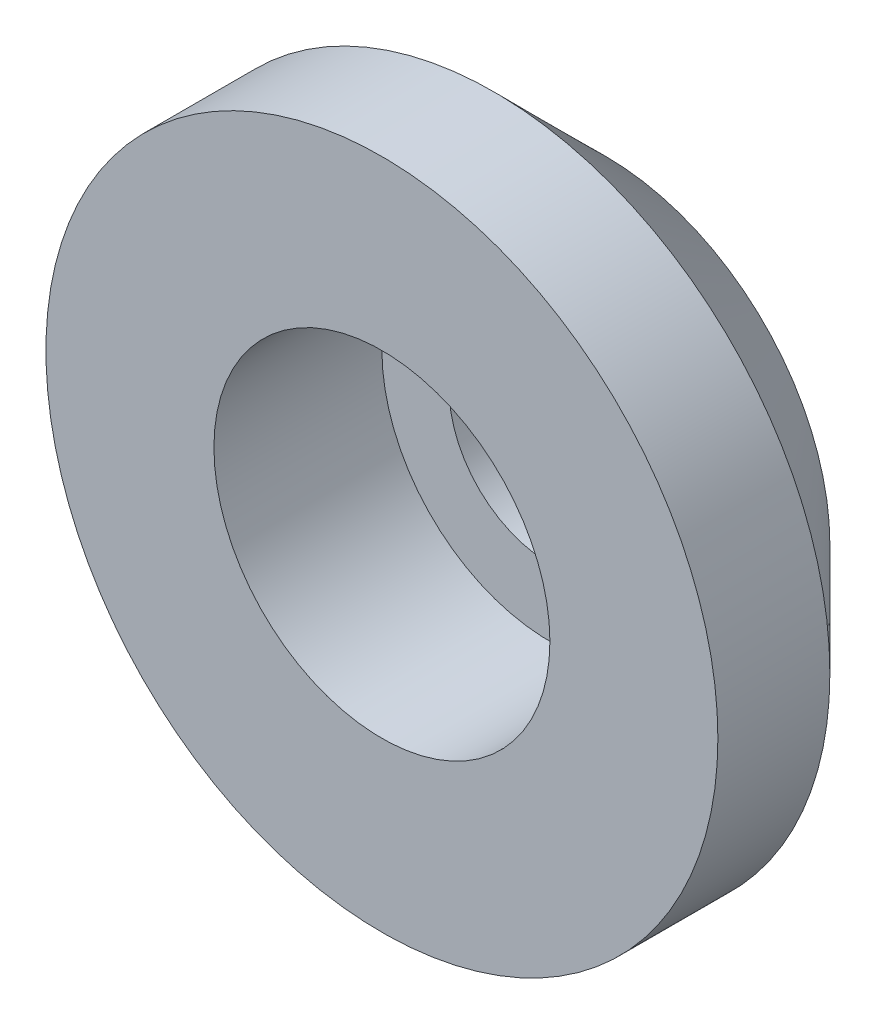
from build123d import *

# Parameters (mm, degrees)
SKETCH1_R           = 3
SKETCH1_R_2         = 0.9
BOSS_EXTRUDE1_DEPTH = 2
CHAMFER1_SIZE       = 1
SKETCH2_R           = 1.5
CUT_EXTRUDE1_DEPTH  = 1.5


with BuildPart() as part:
    # Sketch1 → Boss-Extrude1 (new body)
    with BuildSketch(Plane.XY):
        Circle(SKETCH1_R)
        Circle(SKETCH1_R_2, mode=Mode.SUBTRACT)
    extrude(amount=BOSS_EXTRUDE1_DEPTH)

    # Chamfer1
    chamfer1_edges = [part.edges().sort_by_distance(p)[0] for p in [
        (-3, 0, 0),
    ]]
    chamfer(chamfer1_edges, length=CHAMFER1_SIZE)

    # Sketch2 → Cut-Extrude1 (cut)
    with BuildSketch(Plane.XY.offset(2)):
        Circle(SKETCH2_R)
    extrude(amount=-CUT_EXTRUDE1_DEPTH, mode=Mode.SUBTRACT)


solid = part.part
